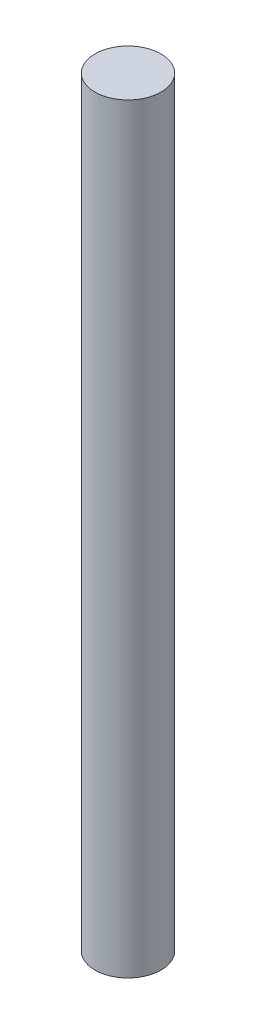
from build123d import *

# Parameters (mm, degrees)
SKETCH_1_R      = 10
EXTRUDE_1_DEPTH = 230


with BuildPart() as part:
    # 草图1 → 凸台-拉伸1 (new body)
    with BuildSketch(Plane(origin=(0, 0, 0), x_dir=(1, 0, 0), z_dir=(0, 1, 0))):
        with Locations(Location((0, 0, 0), (0, 0, 270))):
            Circle(SKETCH_1_R)
    extrude(amount=EXTRUDE_1_DEPTH)


solid = part.part
